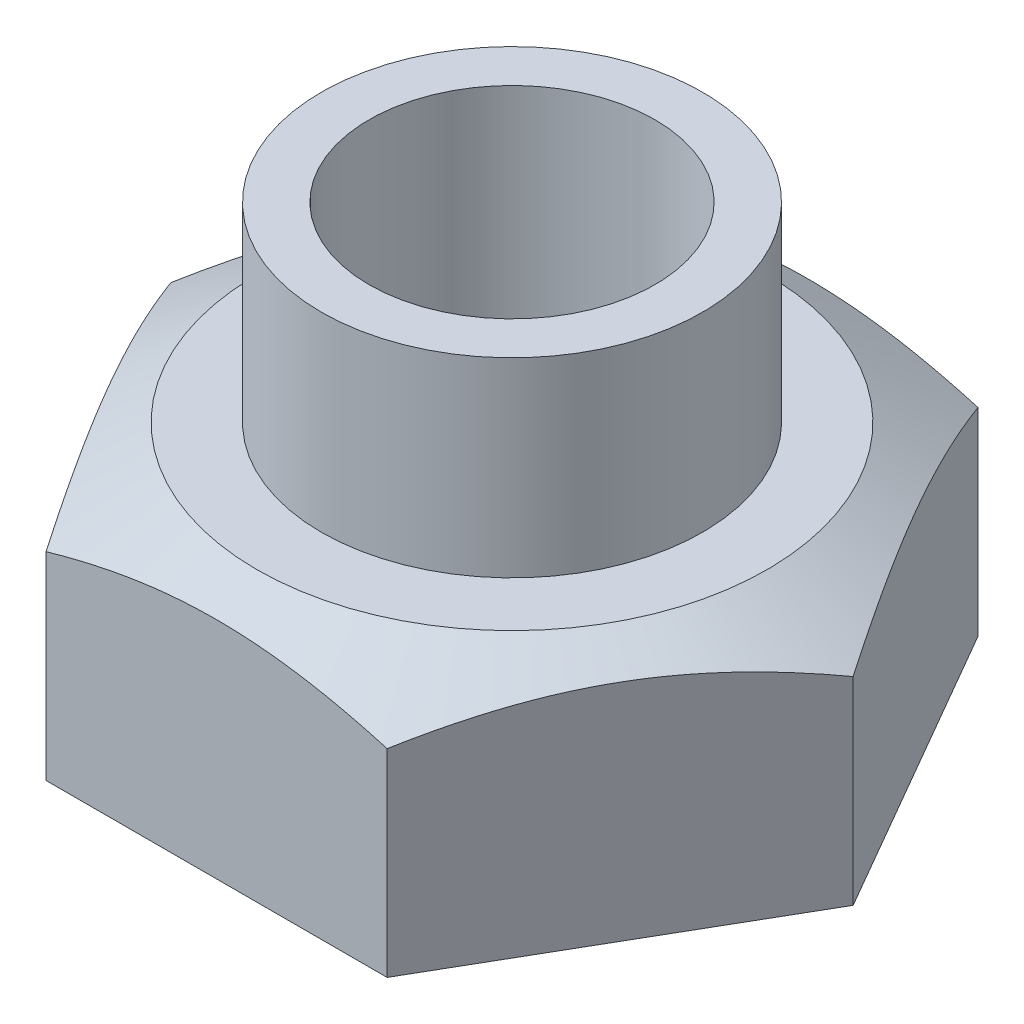
from build123d import *

# Parameters (mm, degrees)
BOSS_EXTRUDE1_DEPTH = 65
SKETCH7_R           = 50
BOSS_EXTRUDE2_DEPTH = 50
SKETCH8_R           = 37.5
CUT_EXTRUDE1_DEPTH  = 166.044186003


with BuildPart() as part:
    # Sketch1 → Boss-Extrude1 (new body)
    with BuildSketch(Plane(origin=(0, 0, 0), x_dir=(1, 0, 0), z_dir=(0, 1, 0))):
        Polygon((44.744645862, -77.5), (89.489291724, 0), (44.744645862, 77.5), (-44.744645862, 77.5), (-89.489291724, 0), (-44.744645862, -77.5), align=None)
    extrude(amount=BOSS_EXTRUDE1_DEPTH)

    # Sketch5 → Cut-Revolve1 (revolve, cut)
    with BuildSketch(Plane.XY, mode=Mode.PRIVATE) as cut_revolve1_sk:
        Polygon((66.946176196, 65), (89.489291724, 65), (89.489291724, 51.984726181), align=None)
    revolve(cut_revolve1_sk.sketch.rotate(Axis((0, 80.544335103, 0), (0, -1, 0)), 300.000000001), axis=Axis((0, 80.544335103, 0), (0, -1, 0)), mode=Mode.SUBTRACT)

    # Sketch7 → Boss-Extrude2 (add)
    with BuildSketch(Plane(origin=(0, 65, 0), x_dir=(1, 0, 0), z_dir=(0, 1, 0))):
        with Locations(Location((0, 0, 0), (0, 0, 270))):
            Circle(SKETCH7_R)
    extrude(amount=BOSS_EXTRUDE2_DEPTH)

    # Sketch8 → Cut-Extrude1 (cut, through all)
    with BuildSketch(Plane(origin=(0, 115, 0), x_dir=(1, 0, 0), z_dir=(0, 1, 0))):
        with Locations(Location((0, 0, 0), (0, 0, 270))):
            Circle(SKETCH8_R)
    extrude(amount=-CUT_EXTRUDE1_DEPTH, mode=Mode.SUBTRACT)


solid = part.part
